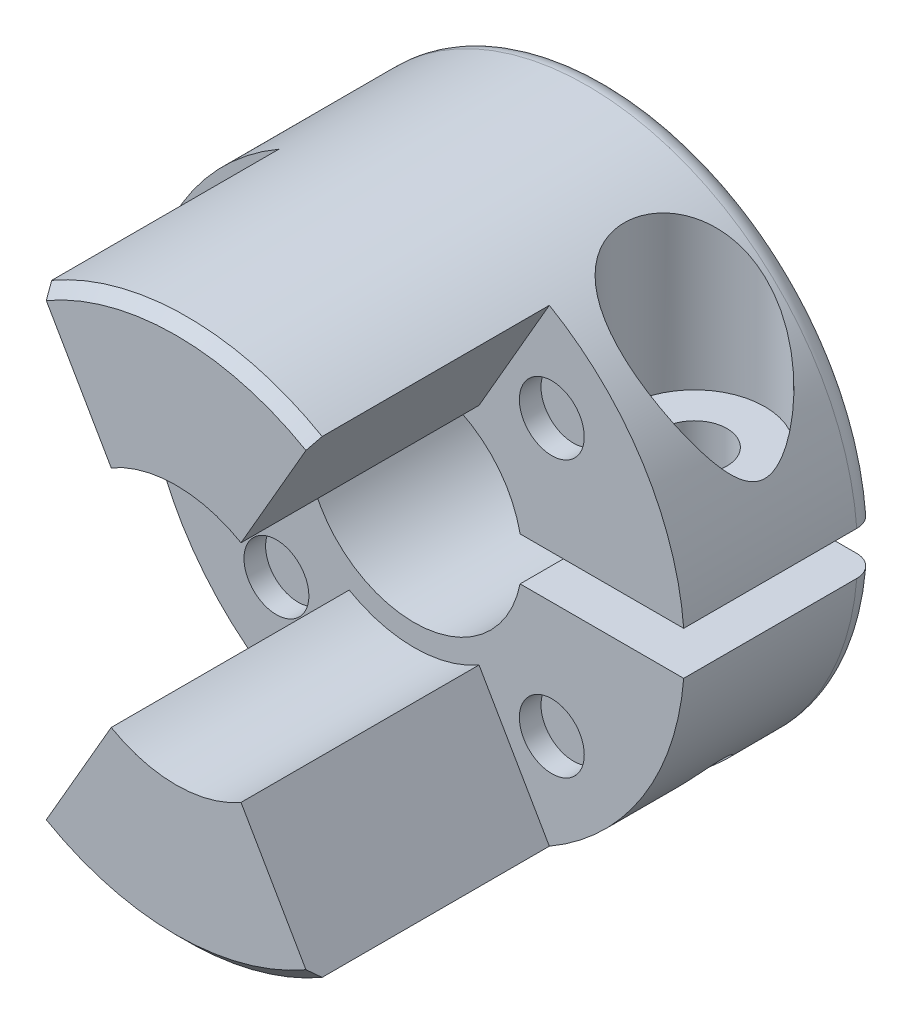
from build123d import *

# Parameters (mm, degrees)
ESBO_O1_R                 = 12.5
RESSALTO_EXTRUS_O1_DEPTH  = 20
CORTE_EXTRUS_O3_START     = -11
CORTE_EXTRUS_O3_DEPTH     = 11
ESBO_O3_R                 = 5
CORTE_EXTRUS_O4_DEPTH     = 27.69269563
ESBO_O6_W                 = 12
ESBO_O6_H                 = 2
CORTE_EXTRUS_O5_DEPTH     = 21.820662814
CORTE_EXTRUS_O6_START     = -3
ESBO_O7_R                 = 3.25
CORTE_EXTRUS_O6_DEPTH     = 25.175356483
FURO_ROSCADO_DE_M3X0_51_D = 2.5
FILETE1_R                 = 1
ESBO_O10_R                = 1.5
CORTE_EXTRUS_O7_DEPTH     = 1
CHANFRO1_SIZE             = 0.5
CORTE_EXTRUS_O8_REACH     = 30.784
ESBO_O11_R                = 1.5
ESBO_O12_R                = 6
CORTE_EXTRUS_O9_DEPTH     = 11
PADR_OCIRCULAR1_COUNT     = 4
CHANFRO2_SIZE             = 0.5


with BuildPart() as part:
    # Esboço1 → Ressalto-extrusão1 (new body)
    with BuildSketch(Plane.XY):
        Circle(ESBO_O1_R)
    extrude(amount=RESSALTO_EXTRUS_O1_DEPTH)

    # Esboço2 → Corte-extrusão3 (cut)
    with BuildSketch(Plane.XY.offset(20).offset(CORTE_EXTRUS_O3_START)):
        with BuildLine():
            Line((0, 0), (6.25, 10.825317547))
            ThreePointArc((6.25, 10.825317547), (12.5, 0), (6.25, -10.825317547))
            Line((6.25, -10.825317547), (0, 0))
        make_face()
    corte_extrus_o3 = extrude(amount=CORTE_EXTRUS_O3_DEPTH, mode=Mode.SUBTRACT)

    # Esboço3 → Corte-extrusão4 (cut, through all)
    with BuildSketch(Plane(origin=(0, 0, 0), x_dir=(-1, 0, 0), z_dir=(0, 0, -1))):
        Circle(ESBO_O3_R)
    extrude(amount=-CORTE_EXTRUS_O4_DEPTH, mode=Mode.SUBTRACT)

    # Espelhar1: Corte-extrusão3 across plane
    add(corte_extrus_o3.mirror(Plane(origin=(0, 0, 0), x_dir=(0, 0, 1), z_dir=(1, 0, 0))), mode=Mode.SUBTRACT)

    # Esboço6 → Corte-extrusão5 (cut, through all)
    with BuildSketch(Plane.XY.offset(9)):
        with Locations((7, 0)):
            Rectangle(ESBO_O6_W, ESBO_O6_H)
    extrude(amount=-CORTE_EXTRUS_O5_DEPTH, mode=Mode.SUBTRACT)

    # Esboço7 → Corte-extrusão6 (cut, through all)
    with BuildSketch(Plane.XZ.offset(-1).offset(CORTE_EXTRUS_O6_START)):
        with Locations(Location((8.459935794, 4.5, 0), (0, 0, 270))):
            Circle(ESBO_O7_R)
    extrude(amount=-CORTE_EXTRUS_O6_DEPTH, mode=Mode.SUBTRACT)

    # Furo roscado de M3x0.51 (through all)
    with Locations(Plane(origin=(0, 4, 0), x_dir=(1, 0, 0), z_dir=(0, 1, 0))):
        with Locations((8.459935794, -4.5)):
            Hole(FURO_ROSCADO_DE_M3X0_51_D / 2)

    # Filete1
    filete1_edges = [part.edges().sort_by_distance(p)[0] for p in [
        (-12.5, 0, 0),
    ]]
    fillet(filete1_edges, radius=FILETE1_R)

    # Esboço10 → Corte-extrusão7 (cut)
    with BuildSketch(Plane.XY.offset(9)):
        with Locations((6.363961031, -6.363961031)):
            Circle(ESBO_O10_R)
    corte_extrus_o7 = extrude(amount=-CORTE_EXTRUS_O7_DEPTH, mode=Mode.SUBTRACT)

    # Chanfro1
    chanfro1_edges = [part.edges().sort_by_distance(p)[0] for p in [
        (0, -12.5, 20),
        (0, 12.5, 20),
    ]]
    chamfer(chanfro1_edges, length=CHANFRO1_SIZE)

    # Esboço11 → Corte-extrusão8 (cut, up to next)
    with BuildSketch(Plane(origin=(0, 4, 0), x_dir=(1, 0, 0), z_dir=(0, 1, 0)), mode=Mode.PRIVATE) as corte_extrus_o8_sk1:
        with Locations(Location((8.459935794, -4.5, 0), (0, 0, 270))):
            Circle(ESBO_O11_R)
    corte_extrus_o8_tool1 = extrude(corte_extrus_o8_sk1.sketch, amount=-CORTE_EXTRUS_O8_REACH, mode=Mode.PRIVATE) & part.part
    add(corte_extrus_o8_tool1.solids().sort_by_distance((8.459936, 4, 4.5))[0], mode=Mode.SUBTRACT)

    # Esboço12 → Corte-extrusão9 (cut)
    with BuildSketch(Plane.XY.offset(20)):
        Circle(ESBO_O12_R)
    extrude(amount=-CORTE_EXTRUS_O9_DEPTH, mode=Mode.SUBTRACT)

    # PadrãoCircular1: Corte-extrusão7 ×4 about axis
    padr_ocircular1_axis = Axis((0, 0, 0), (0, 0, 1))
    for i in range(1, PADR_OCIRCULAR1_COUNT):
        add(corte_extrus_o7.rotate(padr_ocircular1_axis, i * 360 / PADR_OCIRCULAR1_COUNT), mode=Mode.SUBTRACT)

    # Chanfro2
    chanfro2_edges = [part.edges().sort_by_distance(p)[0] for p in [
        (-5, 0, 0),
    ]]
    chamfer(chanfro2_edges, length=CHANFRO2_SIZE)


solid = part.part
